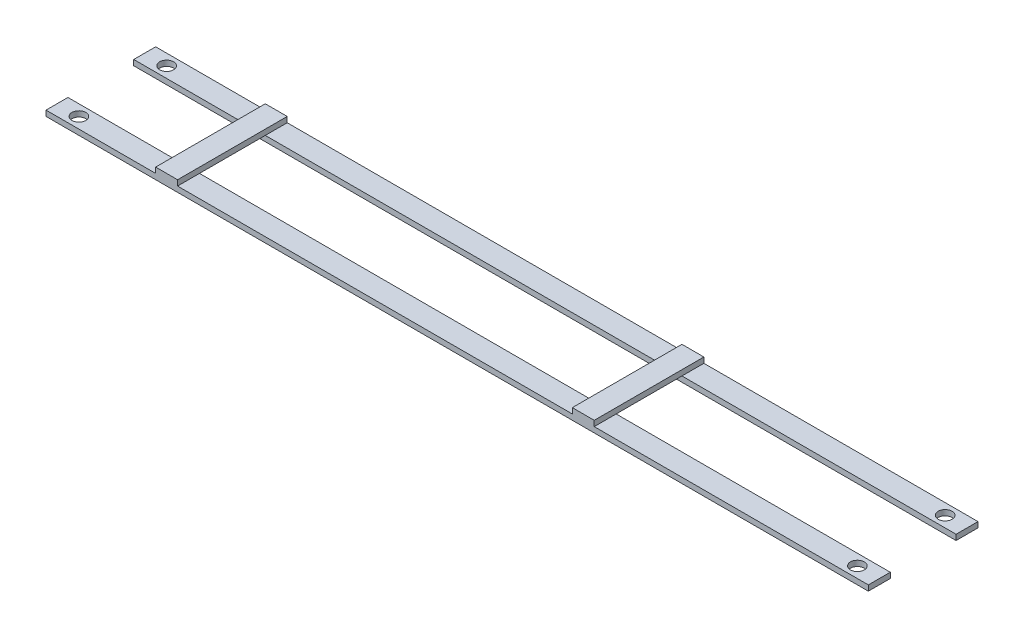
from build123d import *

# Parameters (mm, degrees)
SKETCH1_W           = 1200
SKETCH1_H           = 40
BOSS_EXTRUDE1_DEPTH = 10
SKETCH2_W           = 40
SKETCH2_H           = 200
BOSS_EXTRUDE2_DEPTH = 10
SKETCH3_W           = 1200
SKETCH3_H           = 40
BOSS_EXTRUDE3_DEPTH = 10
SKETCH5_W           = 300
SKETCH5_H           = 40
BOSS_EXTRUDE4_DEPTH = 10
SKETCH4_R           = 12.7
CUT_EXTRUDE1_DEPTH  = 10


with BuildPart() as part:
    # Sketch1 → Boss-Extrude1 (new body)
    with BuildSketch(Plane(origin=(0, 0, 0), x_dir=(1, 0, 0), z_dir=(0, 1, 0))):
        with Locations((600, -20)):
            Rectangle(SKETCH1_W, SKETCH1_H)
    extrude(amount=BOSS_EXTRUDE1_DEPTH)

    # Sketch2 → Boss-Extrude2 (add)
    with BuildSketch(Plane(origin=(0, 10, 0), x_dir=(1, 0, 0), z_dir=(0, 1, 0))):
        with Locations((220, 60)):
            Rectangle(SKETCH2_W, SKETCH2_H)
        with Locations((980, 60)):
            Rectangle(SKETCH2_W, SKETCH2_H)
    extrude(amount=BOSS_EXTRUDE2_DEPTH)

    # Sketch3 → Boss-Extrude3 (add)
    with BuildSketch(Plane.XZ.offset(-10)):
        with Locations((600, -140)):
            Rectangle(SKETCH3_W, SKETCH3_H)
    extrude(amount=BOSS_EXTRUDE3_DEPTH)

    # Sketch5 → Boss-Extrude4 (add)
    with BuildSketch(Plane(origin=(0, 10, 0), x_dir=(1, 0, 0), z_dir=(0, 1, 0))):
        with Locations((1350, 140)):
            Rectangle(SKETCH5_W, SKETCH5_H)
        with Locations((1350, -20)):
            Rectangle(SKETCH5_W, SKETCH5_H)
    extrude(amount=-BOSS_EXTRUDE4_DEPTH)

    # Sketch4 → Cut-Extrude1 (cut)
    with BuildSketch(Plane.XZ):
        with Locations(Location((1460, 20, 0), (0, 0, 270))):
            Circle(SKETCH4_R)
        with Locations(Location((40, 20, 0), (0, 0, 270))):
            Circle(SKETCH4_R)
        with Locations(Location((40, -140, 0), (0, 0, 270))):
            Circle(SKETCH4_R)
        with Locations(Location((1460, -140, 0), (0, 0, 270))):
            Circle(SKETCH4_R)
    extrude(amount=-CUT_EXTRUDE1_DEPTH, mode=Mode.SUBTRACT)


solid = part.part
